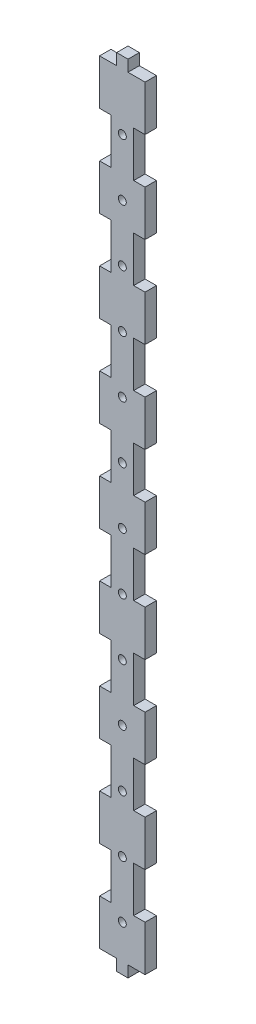
from build123d import *

# Parameters (mm, degrees)
MODEL_R             = 1.75
BOSS_EXTRUDE1_DEPTH = 5


with BuildPart() as part:
    # Model → Boss-Extrude1 (new body)
    with BuildSketch(Plane.XY):
        Polygon((5, -152.5), (0, -152.5), (0, -132.5), (5, -132.5), (5, -112.5), (0, -112.5), (0, -92.5), (5, -92.5), (5, -72.5), (0, -72.5), (0, -52.5), (5, -52.5), (5, -32.5), (0, -32.5), (0, -12.5), (5, -12.5), (5, 7.5), (0, 7.5), (0, 27.5), (5, 27.5), (5, 47.5), (0, 47.5), (0, 67.5), (5, 67.5), (5, 87.5), (0, 87.5), (0, 107.5), (5, 107.5), (5, 127.5), (0, 127.5), (0, 147.5), (5, 147.5), (5, 167.5), (-2.5, 167.5), (-2.5, 172.5), (-7.5, 172.5), (-7.5, 167.5), (-15, 167.5), (-15, 147.5), (-10, 147.5), (-10, 127.5), (-15, 127.5), (-15, 107.5), (-10, 107.5), (-10, 87.5), (-15, 87.5), (-15, 67.5), (-10, 67.5), (-10, 47.5), (-15, 47.5), (-15, 27.5), (-10, 27.5), (-10, 7.5), (-15, 7.5), (-15, -12.5), (-10, -12.5), (-10, -32.5), (-15, -32.5), (-15, -52.5), (-10, -52.5), (-10, -72.5), (-15, -72.5), (-15, -92.5), (-10, -92.5), (-10, -112.5), (-15, -112.5), (-15, -132.5), (-10, -132.5), (-10, -152.5), (-15, -152.5), (-15, -172.5), (-7.5, -172.5), (-7.5, -177.5), (-2.5, -177.5), (-2.5, -172.5), (5, -172.5), align=None)
        with Locations((-5, 142.5)):
            Circle(MODEL_R, mode=Mode.SUBTRACT)
        with Locations((-5, 117.5)):
            Circle(MODEL_R, mode=Mode.SUBTRACT)
        with Locations((-5, 92.5)):
            Circle(MODEL_R, mode=Mode.SUBTRACT)
        with Locations((-5, 67.5)):
            Circle(MODEL_R, mode=Mode.SUBTRACT)
        with Locations((-5, 42.5)):
            Circle(MODEL_R, mode=Mode.SUBTRACT)
        with Locations((-5, 17.5)):
            Circle(MODEL_R, mode=Mode.SUBTRACT)
        with Locations((-5, -7.5)):
            Circle(MODEL_R, mode=Mode.SUBTRACT)
        with Locations((-5, -32.5)):
            Circle(MODEL_R, mode=Mode.SUBTRACT)
        with Locations((-5, -57.5)):
            Circle(MODEL_R, mode=Mode.SUBTRACT)
        with Locations((-5, -82.5)):
            Circle(MODEL_R, mode=Mode.SUBTRACT)
        with Locations((-5, -107.5)):
            Circle(MODEL_R, mode=Mode.SUBTRACT)
        with Locations((-5, -132.5)):
            Circle(MODEL_R, mode=Mode.SUBTRACT)
        with Locations((-5, -157.5)):
            Circle(MODEL_R, mode=Mode.SUBTRACT)
    extrude(amount=BOSS_EXTRUDE1_DEPTH)


solid = part.part
